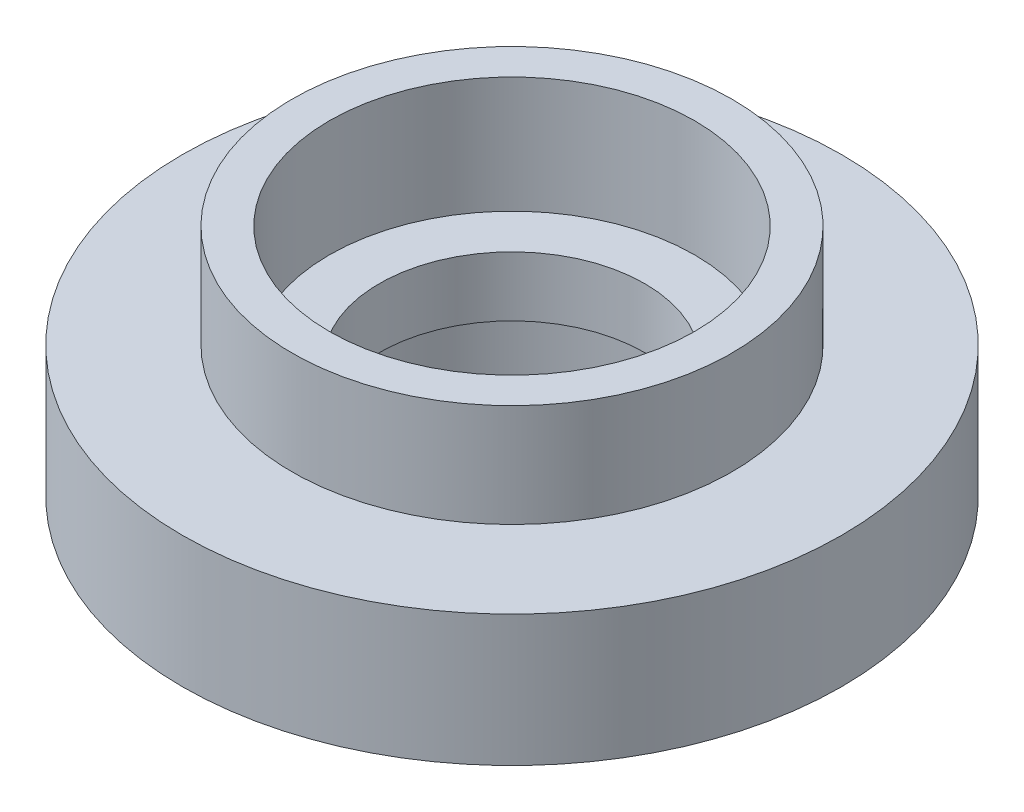
from build123d import *

# Parameters (mm, degrees)
CROQUIS1_R              = 19.86
SALIENTE_EXTRUIR1_DEPTH = 7.9
CROQUIS2_R              = 8
CORTAR_EXTRUIR1_DEPTH   = 7.9
CROQUIS3_R              = 13.25
CROQUIS3_R_2            = 11
SALIENTE_EXTRUIR2_DEPTH = 6.2
SALIENTE_EXTRUIR3_START = 3.5
CROQUIS4_R              = 13.25
CROQUIS4_R_2            = 11
SALIENTE_EXTRUIR3_DEPTH = 3.5
CROQUIS5_R              = 11
CORTAR_EXTRUIR2_DEPTH   = 7
CORTAR_EXTRUIR3_START   = -7
CROQUIS6_R              = 11
CORTAR_EXTRUIR3_DEPTH   = 7


with BuildPart() as part:
    # Croquis1 → Saliente-Extruir1 (new body)
    with BuildSketch(Plane(origin=(0, 0, 0), x_dir=(1, 0, 0), z_dir=(0, 1, 0))):
        with Locations(Location((0, 0, 0), (0, 0, 270))):
            Circle(CROQUIS1_R)
    extrude(amount=SALIENTE_EXTRUIR1_DEPTH)

    # Croquis2 → Cortar-Extruir1 (cut)
    with BuildSketch(Plane(origin=(0, 7.9, 0), x_dir=(1, 0, 0), z_dir=(0, 1, 0))):
        with Locations(Location((0, 0, 0), (0, 0, 270))):
            Circle(CROQUIS2_R)
    extrude(amount=-CORTAR_EXTRUIR1_DEPTH, mode=Mode.SUBTRACT)

    # Croquis3 → Saliente-Extruir2 (add)
    with BuildSketch(Plane(origin=(0, 7.9, 0), x_dir=(1, 0, 0), z_dir=(0, 1, 0))):
        with Locations(Location((0, 0, 0), (0, 0, 90))):
            Circle(CROQUIS3_R)
        with Locations(Location((0, 0, 0), (0, 0, 90))):
            Circle(CROQUIS3_R_2, mode=Mode.SUBTRACT)
    extrude(amount=SALIENTE_EXTRUIR2_DEPTH)

    # Croquis4 → Saliente-Extruir3 (add)
    with BuildSketch(Plane.XZ.offset(SALIENTE_EXTRUIR3_START)):
        with Locations(Location((0, 0, 0), (0, 0, 270))):
            Circle(CROQUIS4_R)
        with Locations(Location((0, 0, 0), (0, 0, 270))):
            Circle(CROQUIS4_R_2, mode=Mode.SUBTRACT)
    extrude(amount=-SALIENTE_EXTRUIR3_DEPTH)

    # Croquis5 → Cortar-Extruir2 (cut)
    with BuildSketch(Plane.XZ.offset(3.5)):
        with Locations(Location((0, 0, 0), (0, 0, 270))):
            Circle(CROQUIS5_R)
    extrude(amount=-CORTAR_EXTRUIR2_DEPTH, mode=Mode.SUBTRACT)

    # Croquis6 → Cortar-Extruir3 (cut)
    with BuildSketch(Plane(origin=(0, 14.1, 0), x_dir=(1, 0, 0), z_dir=(0, 1, 0)).offset(CORTAR_EXTRUIR3_START)):
        with Locations(Location((0, 0, 0), (0, 0, 90))):
            Circle(CROQUIS6_R)
    extrude(amount=CORTAR_EXTRUIR3_DEPTH, mode=Mode.SUBTRACT)


solid = part.part
